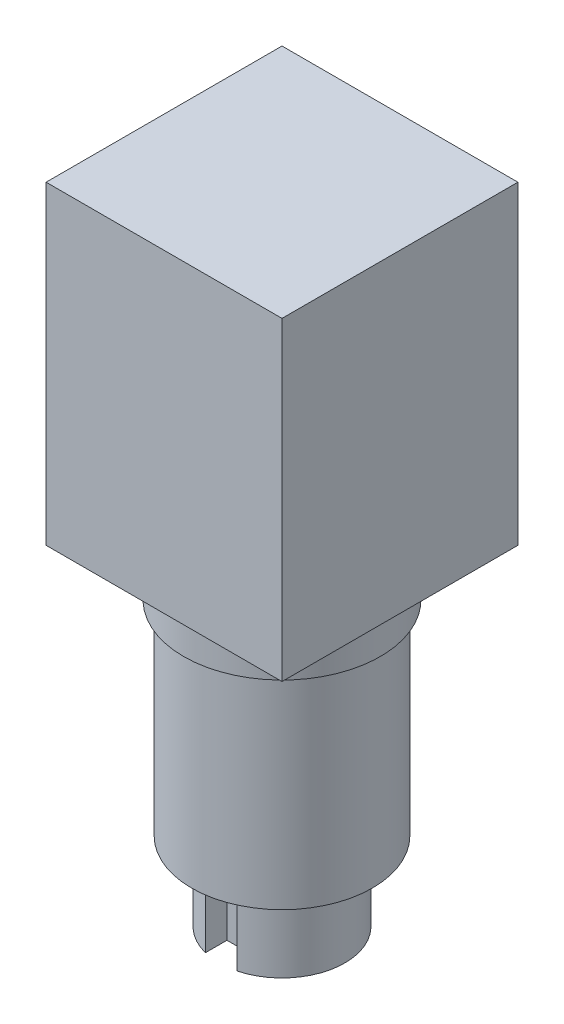
from build123d import *

# Parameters (mm, degrees)
SKETCH2_R                       = 4
BOSS_EXTRUDE1_DEPTH             = 5
SKETCH3_R                       = 5.75
BOSS_EXTRUDE2_DEPTH             = 16
SKETCH4_W                       = 15
SKETCH4_H                       = 15
BOSS_EXTRUDE3_DEPTH             = 20
M2X0_4_TAPPED_HOLE1_D           = 1.6
M2X0_4_TAPPED_HOLE1_DEPTH       = 15
M2X0_4_TAPPED_HOLE1_CSINK_D     = 2.05
M2X0_4_TAPPED_HOLE1_CSINK_ANGLE = 90
M2X0_4_TAPPED_HOLE1_TIP         = 0.480688495
SKETCH10_R                      = 6.25
BOSS_EXTRUDE4_DEPTH             = 3
SKETCH11_W                      = 2
SKETCH11_H                      = 3
CUT_EXTRUDE2_DEPTH              = 5


with BuildPart() as part:
    # Sketch2 → Boss-Extrude1 (new body)
    with BuildSketch(Plane(origin=(0, 0, 0), x_dir=(1, 0, 0), z_dir=(0, 1, 0))):
        with Locations(Location((0, 0, 0), (0, 0, 270))):
            Circle(SKETCH2_R)
    extrude(amount=BOSS_EXTRUDE1_DEPTH)

    # Sketch3 → Boss-Extrude2 (add)
    with BuildSketch(Plane(origin=(0, 5, 0), x_dir=(1, 0, 0), z_dir=(0, 1, 0))):
        with Locations(Location((0, 0, 0), (0, 0, 270))):
            Circle(SKETCH3_R)
    extrude(amount=BOSS_EXTRUDE2_DEPTH)

    # Sketch4 → Boss-Extrude3 (add)
    with BuildSketch(Plane(origin=(0, 21, 0), x_dir=(1, 0, 0), z_dir=(0, 1, 0))):
        Rectangle(SKETCH4_W, SKETCH4_H)
    extrude(amount=BOSS_EXTRUDE3_DEPTH)

    # M2x0.4 Tapped Hole1
    with Locations(Plane(origin=(0, 0, 0), x_dir=(-1, 0, 0), z_dir=(0, -1, 0))):
        with Locations((0, 0)):
            CounterSinkHole(M2X0_4_TAPPED_HOLE1_D / 2, M2X0_4_TAPPED_HOLE1_CSINK_D / 2, depth=M2X0_4_TAPPED_HOLE1_DEPTH, counter_sink_angle=M2X0_4_TAPPED_HOLE1_CSINK_ANGLE)
            with Locations((0, 0, -(M2X0_4_TAPPED_HOLE1_DEPTH + M2X0_4_TAPPED_HOLE1_TIP / 2))):  # 118° drill point
                Cone(0, M2X0_4_TAPPED_HOLE1_D / 2, M2X0_4_TAPPED_HOLE1_TIP, mode=Mode.SUBTRACT)

    # Sketch10 → Boss-Extrude4 (add)
    with BuildSketch(Plane.XZ.offset(-21)):
        with Locations(Location((0, 0, 0), (0, 0, 270))):
            Circle(SKETCH10_R)
    extrude(amount=BOSS_EXTRUDE4_DEPTH)

    # Sketch11 → Cut-Extrude2 (cut)
    with BuildSketch(Plane.XZ):
        with Locations((0, 4)):
            Rectangle(SKETCH11_W, SKETCH11_H)
    extrude(amount=-CUT_EXTRUDE2_DEPTH, mode=Mode.SUBTRACT)


solid = part.part
